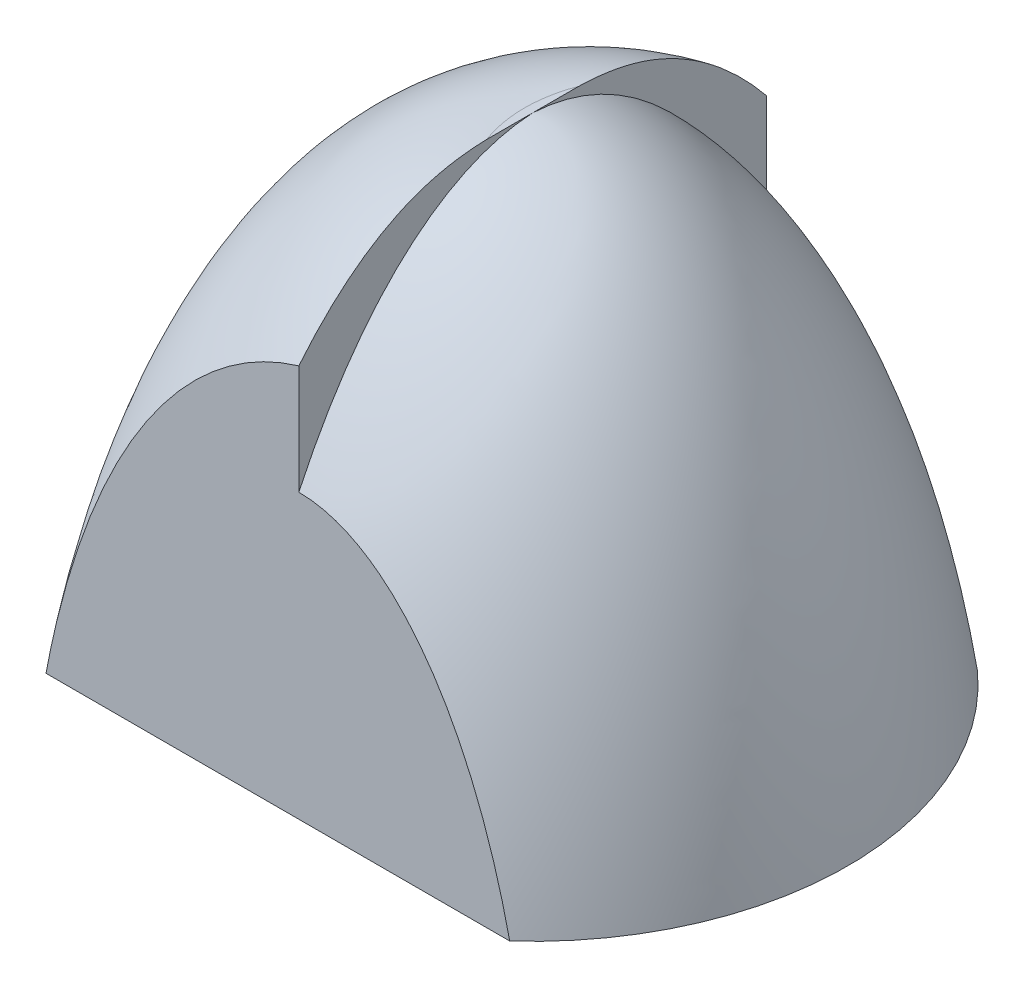
from build123d import *

# Parameters (mm, degrees)
BOSS_EXTRUDE1_DEPTH          = 237.5
BOSS_EXTRUDE1_DEPTH_BACK     = 237.5
SKETCH1_RX                   = 712.26718515
SKETCH1_RY                   = 343.28059296
SKETCH7_W                    = 1048.477934303
SKETCH7_H                    = 944.198935412
CUT_EXTRUDE2_DEPTH           = 923.383384794
CUT_REVOLVE4_ANGLE           = 90
CUT_REVOLVE4_OTHER_WAY_ANGLE = 90


with BuildPart() as part:
    # Sketch1 → Boss-Extrude1 (new, two sides: drawn at the far end of the back side and taken through both)
    with BuildSketch(Plane.XY.offset(-BOSS_EXTRUDE1_DEPTH_BACK)):
        with Locations(Location((0, 0), (0, 0, 90))):
            Ellipse(SKETCH1_RX, SKETCH1_RY)
    extrude(amount=BOSS_EXTRUDE1_DEPTH + BOSS_EXTRUDE1_DEPTH_BACK)

    # Sketch7 → Cut-Extrude2 (cut, through all)
    with BuildSketch(Plane.XY.offset(237.5)):
        with Locations((-29.38771787, -262.502282556)):
            Rectangle(SKETCH7_W, SKETCH7_H)
    extrude(amount=-CUT_EXTRUDE2_DEPTH, mode=Mode.SUBTRACT)

    # Sketch11 → Cut-Revolve2 (revolve, cut)
    with BuildSketch(Plane.XY):
        with BuildLine():
            Line((-343.28059296, 0), (-743.226651757, 0))
            Line((-743.226651757, 0), (-743.226651757, 860.341056905))
            Line((-743.226651757, 860.341056905), (0, 860.341056905))
            Line((0, 860.341056905), (0, 712.26718515))
            add(Edge.make_bspline(
                [(0, 712.26718515), (-343.28059296, 712.26718515), (-343.28059296, 0)],
                knots=[0, 0, 0, 1.570796327, 1.570796327, 1.570796327], degree=2, weights=[1, 0.707106781, 1]))
        make_face()
    revolve(axis=Axis((65.79623911, 0, 0), (0, 1, 0)), mode=Mode.SUBTRACT)

    # Sketch15 → Cut-Revolve4 (revolve, cut)
    with BuildSketch(Plane.XY):
        with BuildLine():
            Line((8.302449854, 946.581815565), (524.826005951, 946.581815565))
            Line((524.826005951, 946.581815565), (524.826005951, 209.59718515))
            Line((524.826005951, 209.59718515), (328.081176474, 209.597185149))
            add(Edge.make_bspline(
                [(328.081176474, 209.597185149), (255.359120318, 699.657333261), (8.302449854, 712.0588366)],
                knots=[5.011078122, 5.011078122, 5.011078122, 6.258997341, 6.258997341, 6.258997341], degree=2, weights=[1, 0.81157141, 1]))
            Line((8.302449854, 712.0588366), (8.302449854, 946.581815565))
        make_face()
    revolve(axis=Axis((8.302449854, 1026.356298718, 0), (0, 1, 0)), revolution_arc=CUT_REVOLVE4_ANGLE, mode=Mode.SUBTRACT)

    # Sketch15 → Cut-Revolve4 other way (revolve, cut)
    with BuildSketch(Plane.XY):
        with BuildLine():
            Line((8.302449854, 946.581815565), (524.826005951, 946.581815565))
            Line((524.826005951, 946.581815565), (524.826005951, 209.59718515))
            Line((524.826005951, 209.59718515), (328.081176474, 209.597185149))
            add(Edge.make_bspline(
                [(328.081176474, 209.597185149), (255.359120318, 699.657333261), (8.302449854, 712.0588366)],
                knots=[5.011078122, 5.011078122, 5.011078122, 6.258997341, 6.258997341, 6.258997341], degree=2, weights=[1, 0.81157141, 1]))
            Line((8.302449854, 712.0588366), (8.302449854, 946.581815565))
        make_face()
    revolve(axis=Axis((8.302449854, 1026.356298718, 0), (0, -1, 0)), revolution_arc=CUT_REVOLVE4_OTHER_WAY_ANGLE, mode=Mode.SUBTRACT)


solid = part.part
